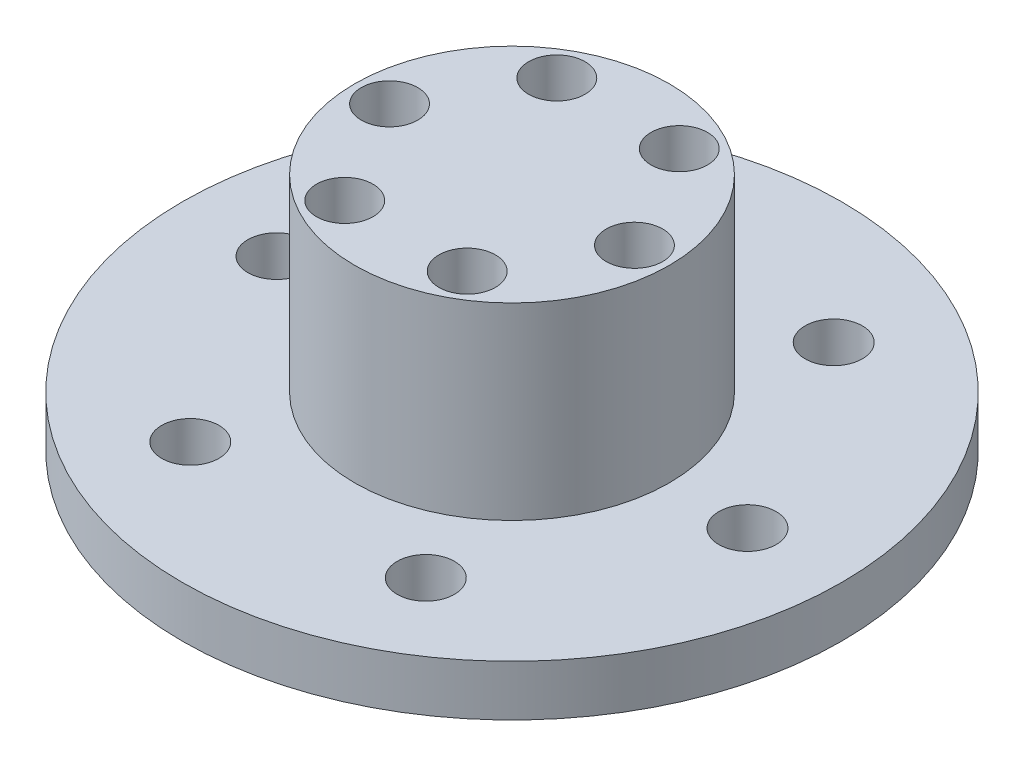
from build123d import *

# Parameters (mm, degrees)
CROQUIS1_R              = 17.5
CROQUIS1_R_2            = 1.52
SALIENTE_EXTRUIR1_DEPTH = 2.7
CROQUIS2_R              = 8.35
CROQUIS2_R_2            = 1.5
SALIENTE_EXTRUIR2_DEPTH = 10


with BuildPart() as part:
    # Croquis1 → Saliente-Extruir1 (new body)
    with BuildSketch(Plane(origin=(0, 0, 0), x_dir=(1, 0, 0), z_dir=(0, 1, 0))):
        with Locations(Location((0, 0, 0), (0, 0, 90))):
            Circle(CROQUIS1_R)
        with Locations(Location((12.5, 0, 0), (0, 0, 90))):
            Circle(CROQUIS1_R_2, mode=Mode.SUBTRACT)
        with Locations(Location((6.25, -10.825317547, 0), (0, 0, 90))):
            Circle(CROQUIS1_R_2, mode=Mode.SUBTRACT)
        with Locations(Location((-6.25, -10.825317547, 0), (0, 0, 90))):
            Circle(CROQUIS1_R_2, mode=Mode.SUBTRACT)
        with Locations(Location((-12.5, 0, 0), (0, 0, 90))):
            Circle(CROQUIS1_R_2, mode=Mode.SUBTRACT)
        with Locations(Location((-6.25, 10.825317547, 0), (0, 0, 90))):
            Circle(CROQUIS1_R_2, mode=Mode.SUBTRACT)
        with Locations(Location((6.25, 10.825317547, 0), (0, 0, 90))):
            Circle(CROQUIS1_R_2, mode=Mode.SUBTRACT)
    extrude(amount=SALIENTE_EXTRUIR1_DEPTH)

    # Croquis2 → Saliente-Extruir2 (add)
    with BuildSketch(Plane(origin=(0, 2.7, 0), x_dir=(1, 0, 0), z_dir=(0, 1, 0))):
        with Locations(Location((0, 0, 0), (0, 0, 270))):
            Circle(CROQUIS2_R)
        with Locations(Location((6.5, 0, 0), (0, 0, 270))):
            Circle(CROQUIS2_R_2, mode=Mode.SUBTRACT)
        with Locations(Location((3.25, -5.629165125, 0), (0, 0, 270))):
            Circle(CROQUIS2_R_2, mode=Mode.SUBTRACT)
        with Locations(Location((-3.25, -5.629165125, 0), (0, 0, 270))):
            Circle(CROQUIS2_R_2, mode=Mode.SUBTRACT)
        with Locations(Location((-6.5, 0, 0), (0, 0, 270))):
            Circle(CROQUIS2_R_2, mode=Mode.SUBTRACT)
        with Locations(Location((-3.25, 5.629165125, 0), (0, 0, 270))):
            Circle(CROQUIS2_R_2, mode=Mode.SUBTRACT)
        with Locations(Location((3.25, 5.629165125, 0), (0, 0, 270))):
            Circle(CROQUIS2_R_2, mode=Mode.SUBTRACT)
    extrude(amount=SALIENTE_EXTRUIR2_DEPTH)


solid = part.part
